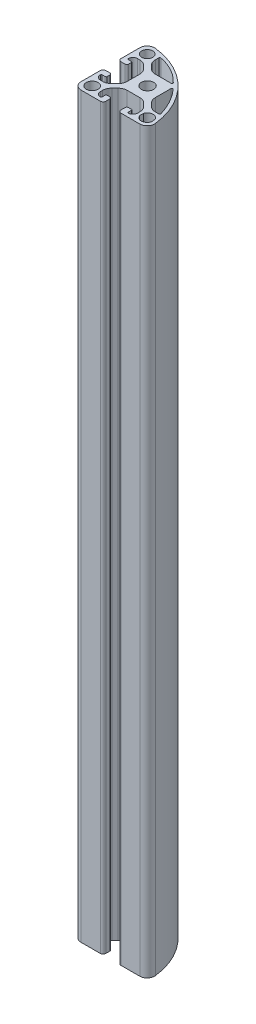
from build123d import *

# Parameters (mm, degrees)
CROQUIS1_R              = 3.35
SALIENTE_EXTRUIR1_DEPTH = 400
SALIENTE_EXTRUIR2_START = -400
SALIENTE_EXTRUIR2_DEPTH = 400


with BuildPart() as part:
    # Croquis1 → Saliente-Extruir1 (new body)
    with BuildSketch(Plane(origin=(0, 0, 0), x_dir=(1, 0, 0), z_dir=(0, 1, 0))):
        with BuildLine():
            Line((4.099999986, -16.349999949), (4.099999986, -18.499999949))
            ThreePointArc((4.099999986, -18.499999949), (4.539339815, -19.560660121), (5.599999987, -19.999999949))
            Line((5.599999987, -19.999999949), (15.777087623, -19.999999949))
            ThreePointArc((15.777087623, -19.999999949), (18.758511608, -18.66666665), (19.752319619, -15.555555546))
            ThreePointArc((19.752319619, -15.555555546), (8.284271243, 8.284271252), (-15.555555578, 19.752319582))
            ThreePointArc((-15.555555578, 19.752319582), (-18.666666685, 18.758511591), (-20.000000016, 15.777087623))
            Line((-20.000000016, 15.777087623), (-20.000000016, 5.599999985))
            ThreePointArc((-20.000000016, 5.599999985), (-19.560660185, 4.539339815), (-18.500000013, 4.099999988))
            Line((-18.500000013, 4.099999988), (-16.350000012, 4.099999988))
            ThreePointArc((-16.350000012, 4.099999988), (-15.642893231, 4.392893207), (-15.350000012, 5.099999988))
            Line((-15.350000012, 5.099999988), (-15.350000012, 6.599999984))
            ThreePointArc((-15.350000012, 6.599999984), (-15.49644662, 6.953553378), (-15.850000012, 7.099999989))
            Line((-15.850000012, 7.099999989), (-17.500000009, 7.099999989))
            ThreePointArc((-17.500000009, 7.099999989), (-17.853553401, 7.246446596), (-18.000000013, 7.599999985))
            ThreePointArc((-18.000000013, 7.599999985), (-17.267766972, 9.36776695), (-15.500000013, 10.100000003))
            Line((-15.500000013, 10.100000003), (-14.292388135, 10.100000003))
            ThreePointArc((-14.292388135, 10.100000003), (-12.378970991, 9.719397659), (-10.756854262, 8.635533909))
            Line((-10.756854262, 8.635533909), (-9.064466108, 6.943145756))
            ThreePointArc((-9.064466108, 6.943145756), (-7.980602349, 5.32102901), (-7.60000001, 3.407611846))
            Line((-7.60000001, 3.407611846), (-7.60000001, -3.407611843))
            ThreePointArc((-7.60000001, -3.407611843), (-7.980602347, -5.321029004), (-9.064466104, -6.943145748))
            Line((-9.064466104, -6.943145748), (-10.756854257, -8.635533901))
            ThreePointArc((-10.756854257, -8.635533901), (-12.378971003, -9.719397661), (-14.292388167, -10.099999999))
            Line((-14.292388167, -10.099999999), (-15.499999985, -10.099999999))
            ThreePointArc((-15.499999985, -10.099999999), (-17.267766956, -9.367766956), (-18.000000007, -7.599999987))
            ThreePointArc((-18.000000007, -7.599999987), (-17.853553397, -7.246446598), (-17.500000007, -7.099999989))
            Line((-17.500000007, -7.099999989), (-15.850000011, -7.099999989))
            ThreePointArc((-15.850000011, -7.099999989), (-15.496446618, -6.953553381), (-15.350000008, -6.599999989))
            Line((-15.350000008, -6.599999989), (-15.350000008, -5.099999989))
            ThreePointArc((-15.350000008, -5.099999989), (-15.642893227, -4.392893209), (-16.350000008, -4.09999999))
            Line((-16.350000008, -4.09999999), (-18.500000008, -4.09999999))
            ThreePointArc((-18.500000008, -4.09999999), (-19.56066018, -4.539339819), (-20.000000008, -5.599999991))
            Line((-20.000000008, -5.599999991), (-20.000000008, -15.999999939))
            ThreePointArc((-20.000000008, -15.999999939), (-18.828427101, -18.828427077), (-15.999999951, -19.999999954))
            Line((-15.999999951, -19.999999954), (-5.599999986, -19.999999954))
            ThreePointArc((-5.599999986, -19.999999954), (-4.539339818, -19.560660123), (-4.099999992, -18.499999954))
            Line((-4.099999992, -18.499999954), (-4.099999992, -16.349999953))
            ThreePointArc((-4.099999992, -16.349999953), (-4.392893211, -15.642893171), (-5.099999992, -15.349999953))
            Line((-5.099999992, -15.349999953), (-6.599999988, -15.349999953))
            ThreePointArc((-6.599999988, -15.349999953), (-6.953553382, -15.49644656), (-7.099999993, -15.849999953))
            Line((-7.099999993, -15.849999953), (-7.099999993, -17.499999952))
            ThreePointArc((-7.099999993, -17.499999952), (-7.2464466, -17.853553342), (-7.599999989, -17.999999954))
            ThreePointArc((-7.599999989, -17.999999954), (-9.367766954, -17.267766913), (-10.100000007, -15.499999954))
            Line((-10.100000007, -15.499999954), (-10.100000007, -14.292388076))
            ThreePointArc((-10.100000007, -14.292388076), (-9.719397663, -12.378970931), (-8.635533913, -10.756854202))
            Line((-8.635533913, -10.756854202), (-6.94314576, -9.064466049))
            ThreePointArc((-6.94314576, -9.064466049), (-5.321029014, -7.980602289), (-3.40761185, -7.599999951))
            Line((-3.40761185, -7.599999951), (3.407611837, -7.599999951))
            ThreePointArc((3.407611837, -7.599999951), (5.321028999, -7.980602288), (6.943145744, -9.064466044))
            Line((6.943145744, -9.064466044), (8.635533897, -10.756854198))
            ThreePointArc((8.635533897, -10.756854198), (9.719397657, -12.378970943), (10.099999995, -14.292388108))
            Line((10.099999995, -14.292388108), (10.099999995, -15.499999937))
            ThreePointArc((10.099999995, -15.499999937), (9.367766948, -17.267766901), (7.599999983, -17.999999948))
            ThreePointArc((7.599999983, -17.999999948), (7.246446594, -17.853553337), (7.099999985, -17.499999948))
            Line((7.099999985, -17.499999948), (7.099999985, -15.849999952))
            ThreePointArc((7.099999985, -15.849999952), (6.953553377, -15.496446559), (6.599999985, -15.349999949))
            Line((6.599999985, -15.349999949), (5.099999986, -15.349999949))
            ThreePointArc((5.099999986, -15.349999949), (4.392893205, -15.642893168), (4.099999986, -16.349999949))
        make_face()
        with Locations(Location((0, 0, 0), (0, 0, 270))):
            Circle(CROQUIS1_R, mode=Mode.SUBTRACT)
        with BuildLine():
            Line((-18.200000016, 12.299999981), (-18.200000016, 15.777087623))
            ThreePointArc((-18.200000016, 15.777087623), (-17.466666684, 17.416870805), (-15.755555575, 17.963465201))
            ThreePointArc((-15.755555575, 17.963465201), (-13.970008189, 17.721071), (-12.197878052, 17.394744174))
            ThreePointArc((-12.197878052, 17.394744174), (-11.91201741, 17.22067196), (-11.800000067, 16.905284013))
            Line((-11.800000067, 16.905284013), (-11.800000067, 12.299999704))
            ThreePointArc((-11.800000067, 12.299999704), (-11.946446503, 11.946446622), (-12.299999521, 11.800000031))
            Line((-12.299999521, 11.800000031), (-17.700000056, 11.800000031))
            ThreePointArc((-17.700000056, 11.800000031), (-18.053553418, 11.946446622), (-18.200000016, 12.299999981))
        make_face(mode=Mode.SUBTRACT)
        with BuildLine():
            Line((11.800000005, -17.699999962), (11.800000005, -12.299999803))
            ThreePointArc((11.800000005, -12.299999803), (11.946446442, -11.946446721), (12.299999459, -11.80000013))
            Line((12.299999459, -11.80000013), (16.905284227, -11.80000013))
            ThreePointArc((16.905284227, -11.80000013), (17.220672032, -11.912017476), (17.394744196, -12.197877993))
            ThreePointArc((17.394744196, -12.197877993), (17.721071033, -13.970008163), (17.963465241, -15.755555583))
            ThreePointArc((17.963465241, -15.755555583), (17.416870817, -17.466666655), (15.777087646, -18.199999948))
            Line((15.777087646, -18.199999948), (12.300000016, -18.199999948))
            ThreePointArc((12.300000016, -18.199999948), (11.946446626, -18.053553344), (11.800000005, -17.699999962))
        make_face(mode=Mode.SUBTRACT)
        with BuildLine():
            Line((-18.200000037, -15.999999938), (-18.200000037, -12.29999998))
            ThreePointArc((-18.200000037, -12.29999998), (-18.053553433, -11.94644659), (-17.70000005, -11.799999969))
            Line((-17.70000005, -11.799999969), (-12.299999814, -11.799999969))
            ThreePointArc((-12.299999814, -11.799999969), (-11.946446646, -11.946446393), (-11.800000043, -12.299999487))
            Line((-11.800000043, -12.299999487), (-11.800000043, -17.700000023))
            ThreePointArc((-11.800000043, -17.700000023), (-11.946446635, -18.053553384), (-12.299999994, -18.199999983))
            Line((-12.299999994, -18.199999983), (-15.999999951, -18.199999983))
            ThreePointArc((-15.999999951, -18.199999983), (-17.555634915, -17.555634891), (-18.200000037, -15.999999938))
        make_face(mode=Mode.SUBTRACT)
        with BuildLine():
            Line((-10.100000018, 14.292388152), (-10.100000018, 16.237135643))
            ThreePointArc((-10.100000018, 16.237135643), (-9.900860854, 16.636488564), (-9.462068989, 16.717734255))
            ThreePointArc((-9.462068989, 16.717734255), (-1.335812596, 13.79371517), (5.466577064, 8.472679041))
            ThreePointArc((5.466577064, 8.472679041), (5.600331365, 7.921589685), (5.133244904, 7.599999995))
            Line((5.133244904, 7.599999995), (-3.407611859, 7.599999995))
            ThreePointArc((-3.407611859, 7.599999995), (-5.321029022, 7.980602332), (-6.943145766, 9.064466088))
            Line((-6.943145766, 9.064466088), (-8.63553392, 10.756854242))
            ThreePointArc((-8.63553392, 10.756854242), (-9.719397679, 12.378970987), (-10.100000018, 14.292388152))
        make_face(mode=Mode.SUBTRACT)
        with BuildLine():
            Line((16.237135661, -10.099999987), (14.292388142, -10.099999987))
            ThreePointArc((14.292388142, -10.099999987), (12.378970987, -9.719397647), (10.75685425, -8.635533892))
            Line((10.75685425, -8.635533892), (9.064466096, -6.943145739))
            ThreePointArc((9.064466096, -6.943145739), (7.980602337, -5.321028994), (7.599999998, -3.407611829))
            Line((7.599999998, -3.407611829), (7.599999998, 5.133244926))
            ThreePointArc((7.599999998, 5.133244926), (7.921589687, 5.600331384), (8.472679039, 5.466577086))
            ThreePointArc((8.472679039, 5.466577086), (13.438953564, -1.531746557), (16.71773428, -9.462068964))
            ThreePointArc((16.71773428, -9.462068964), (16.636488582, -9.900860826), (16.237135661, -10.099999987))
        make_face(mode=Mode.SUBTRACT)
    extrude(amount=SALIENTE_EXTRUIR1_DEPTH)

    # Croquis2 → Saliente-Extruir2 (add)
    with BuildSketch(Plane(origin=(0, 400, 0), x_dir=(1, 0, 0), z_dir=(0, 1, 0)).offset(SALIENTE_EXTRUIR2_START)):
        with BuildLine():
            ThreePointArc((-15.00000005, -11.799999969), (-12.737258345, -12.737258271), (-11.800000043, -14.999999976))
            Line((-11.800000043, -14.999999976), (-11.800000043, -12.299999487))
            ThreePointArc((-11.800000043, -12.299999487), (-11.946446646, -11.946446393), (-12.299999814, -11.799999969))
            Line((-12.299999814, -11.799999969), (-15.00000005, -11.799999969))
        make_face()
        with BuildLine():
            ThreePointArc((-11.800000043, -14.999999976), (-12.737258345, -17.26274168), (-15.00000005, -18.199999983))
            Line((-15.00000005, -18.199999983), (-12.299999994, -18.199999983))
            ThreePointArc((-12.299999994, -18.199999983), (-11.946446635, -18.053553384), (-11.800000043, -17.700000023))
            Line((-11.800000043, -17.700000023), (-11.800000043, -14.999999976))
        make_face()
        with BuildLine():
            ThreePointArc((-18.200000037, -15.999999938), (-17.555634915, -17.555634891), (-15.999999951, -18.199999983))
            Line((-15.999999951, -18.199999983), (-15.00000005, -18.199999983))
            ThreePointArc((-15.00000005, -18.199999983), (-17.262741755, -17.26274168), (-18.200000057, -14.999999976))
            Line((-18.200000037, -14.999999976), (-18.200000037, -15.999999938))
        make_face()
        with BuildLine():
            Line((-18.200000037, -12.29999998), (-18.200000037, -14.999999976))
            ThreePointArc((-18.200000057, -14.999999976), (-17.262741755, -12.737258271), (-15.00000005, -11.799999969))
            Line((-15.00000005, -11.799999969), (-17.70000005, -11.799999969))
            ThreePointArc((-17.70000005, -11.799999969), (-18.053553433, -11.94644659), (-18.200000037, -12.29999998))
        make_face()
        with BuildLine():
            ThreePointArc((-15.755555575, 17.963465201), (-17.466666684, 17.416870805), (-18.200000016, 15.777087623))
            Line((-18.200000016, 15.777087623), (-18.200000016, 12.299999981))
            ThreePointArc((-18.200000016, 12.299999981), (-18.053553418, 11.946446622), (-17.700000056, 11.800000031))
            Line((-17.700000056, 11.800000031), (-14.992840663, 11.800000031))
            ThreePointArc((-14.992840663, 11.800000031), (-18.006058488, 15.03645487), (-14.562863205, 17.811076975))
            ThreePointArc((-14.562863205, 17.811076975), (-15.158609779, 17.891964046), (-15.755555575, 17.963465201))
        make_face()
        with BuildLine():
            ThreePointArc((-12.197878052, 17.394744174), (-13.37709835, 17.621498805), (-14.562863205, 17.811076975))
            ThreePointArc((-14.562863205, 17.811076975), (-12.709765496, 16.799175178), (-11.971923864, 14.82091683))
            ThreePointArc((-11.971923864, 14.82091683), (-12.856729909, 12.684806076), (-14.992840663, 11.800000031))
            Line((-14.992840663, 11.800000031), (-12.299999521, 11.800000031))
            ThreePointArc((-12.299999521, 11.800000031), (-11.946446503, 11.946446622), (-11.800000067, 12.299999704))
            Line((-11.800000067, 12.299999704), (-11.800000067, 16.905284013))
            ThreePointArc((-11.800000067, 16.905284013), (-11.91201741, 17.22067196), (-12.197878052, 17.394744174))
        make_face()
        with BuildLine():
            Line((16.905284227, -11.80000013), (14.828541229, -11.80000013))
            ThreePointArc((14.828541229, -11.80000013), (16.461401303, -12.247952184), (17.637109474, -13.466395191))
            ThreePointArc((17.637109474, -13.466395191), (17.521287961, -12.831112285), (17.394744196, -12.197877993))
            ThreePointArc((17.394744196, -12.197877993), (17.220672032, -11.912017476), (16.905284227, -11.80000013))
        make_face()
        with BuildLine():
            Line((11.800000005, -12.299999803), (11.800000005, -13.966589436))
            ThreePointArc((11.800000005, -13.966589436), (12.966675823, -12.397413513), (14.828541229, -11.80000013))
            Line((14.828541229, -11.80000013), (12.299999459, -11.80000013))
            ThreePointArc((12.299999459, -11.80000013), (11.946446442, -11.946446721), (11.800000005, -12.299999803))
        make_face()
        with BuildLine():
            ThreePointArc((11.800000005, -17.699999962), (11.946446626, -18.053553344), (12.300000016, -18.199999948))
            Line((12.300000016, -18.199999948), (14.828541229, -18.199999948))
            ThreePointArc((14.828541229, -18.199999948), (12.966675823, -17.602586565), (11.800000005, -16.033410642))
            Line((11.800000005, -16.033410642), (11.800000005, -17.699999962))
        make_face()
        with BuildLine():
            ThreePointArc((17.955118446, -15.681552916), (16.835906452, -17.492084364), (14.828541229, -18.199999948))
            Line((14.828541229, -18.199999948), (15.777087646, -18.199999948))
            ThreePointArc((15.777087646, -18.199999948), (17.416870817, -17.466666655), (17.963465241, -15.755555583))
            ThreePointArc((17.963465241, -15.755555583), (17.959309877, -15.718552215), (17.955118446, -15.681552916))
        make_face()
    extrude(amount=SALIENTE_EXTRUIR2_DEPTH)


solid = part.part
